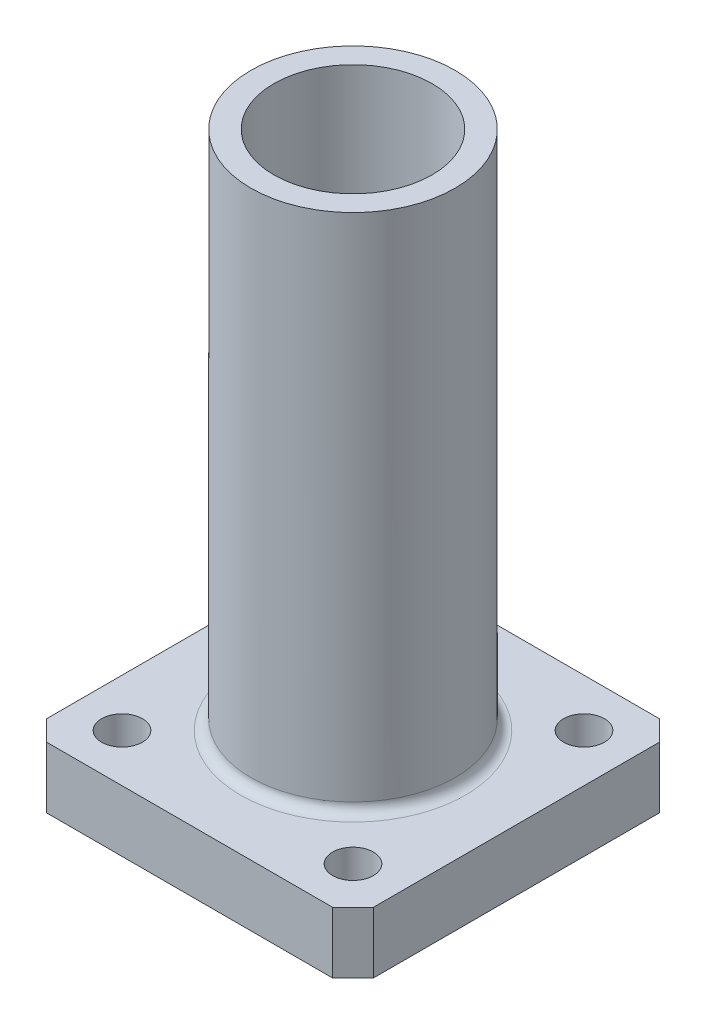
from build123d import *

# Parameters (mm, degrees)
SKETCH1_R           = 2
BOSS_EXTRUDE1_DEPTH = 6
SKETCH2_R           = 10
BOSS_EXTRUDE2_DEPTH = 51
SKETCH3_R           = 7.75
CUT_EXTRUDE1_DEPTH  = 62.558024733
FILLET1_R           = 1


with BuildPart() as part:
    # Sketch1 → Boss-Extrude1 (new body)
    with BuildSketch(Plane(origin=(0, 0, 0), x_dir=(1, 0, 0), z_dir=(0, 1, 0))):
        Polygon((-16.274775851, 13.401142209), (-14.274775851, 15.401142209), (13.725224149, 15.401142209), (15.725224149, 13.401142209), (15.725224149, -14.598857791), (13.725224149, -16.598857791), (-14.274775851, -16.598857791), (-16.274775851, -14.598857791), align=None)
        with Locations(Location((11.038932647, 10.714850708, 0), (0, 0, 270))):
            Circle(SKETCH1_R, mode=Mode.SUBTRACT)
        with Locations(Location((-11.58848435, 10.714850708, 0), (0, 0, 270))):
            Circle(SKETCH1_R, mode=Mode.SUBTRACT)
        with Locations(Location((-11.58848435, -11.91256629, 0), (0, 0, 270))):
            Circle(SKETCH1_R, mode=Mode.SUBTRACT)
        with Locations(Location((11.038932647, -11.91256629, 0), (0, 0, 270))):
            Circle(SKETCH1_R, mode=Mode.SUBTRACT)
    extrude(amount=BOSS_EXTRUDE1_DEPTH)

    # Sketch2 → Boss-Extrude2 (add)
    with BuildSketch(Plane(origin=(0, 6, 0), x_dir=(1, 0, 0), z_dir=(0, 1, 0))):
        with Locations(Location((-0.274775851, -0.598857791, 0), (0, 0, 90))):
            Circle(SKETCH2_R)
    extrude(amount=BOSS_EXTRUDE2_DEPTH)

    # Sketch3 → Cut-Extrude1 (cut, through all)
    with BuildSketch(Plane(origin=(0, 57, 0), x_dir=(1, 0, 0), z_dir=(0, 1, 0))):
        with Locations(Location((-0.274775851, -0.598857791, 0), (0, 0, 270))):
            Circle(SKETCH3_R)
    extrude(amount=-CUT_EXTRUDE1_DEPTH, mode=Mode.SUBTRACT)

    # Fillet1
    fillet1_edges = [part.edges().sort_by_distance(p)[0] for p in [
        (-0.274775851, 6, 10.598857791),
    ]]
    fillet(fillet1_edges, radius=FILLET1_R)


solid = part.part
